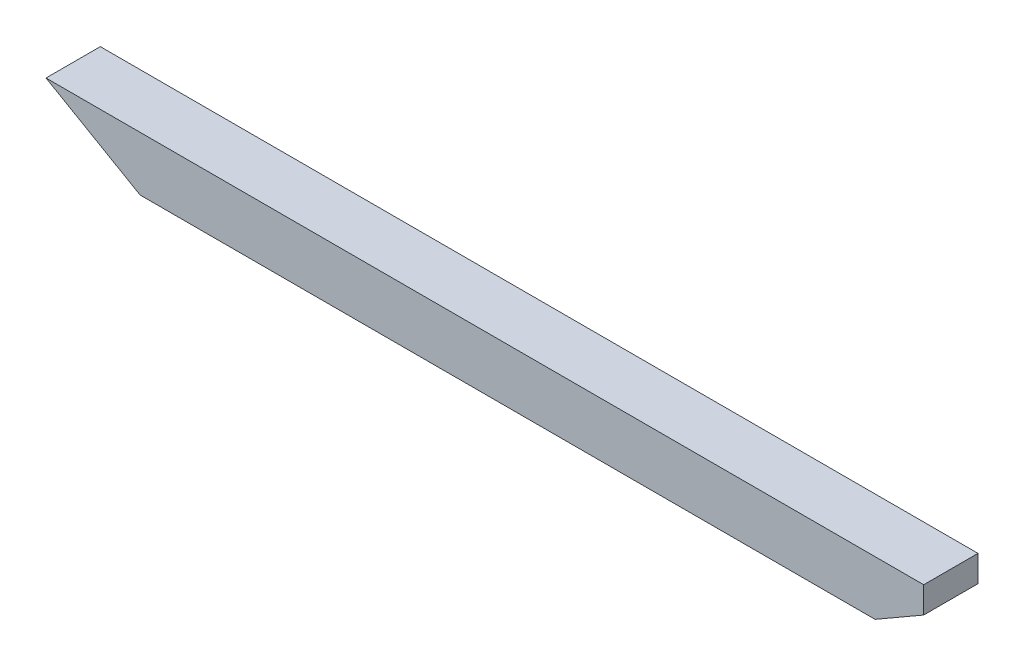
from build123d import *

# Parameters (mm, degrees)
BOSS_EXTRUDE2_DEPTH = 20


with BuildPart() as part:
    # Sketch1 → Boss-Extrude2 (new body)
    with BuildSketch(Plane.XY):
        Polygon((-183.598691887, 34.384251385), (121.665400161, 34.384251385), (139.565400161, 34.384251385), (139.565400161, 24.714251385), (121.665400161, 14.384251385), (-148.954599839, 14.384251385), align=None)
    extrude(amount=BOSS_EXTRUDE2_DEPTH)


solid = part.part
